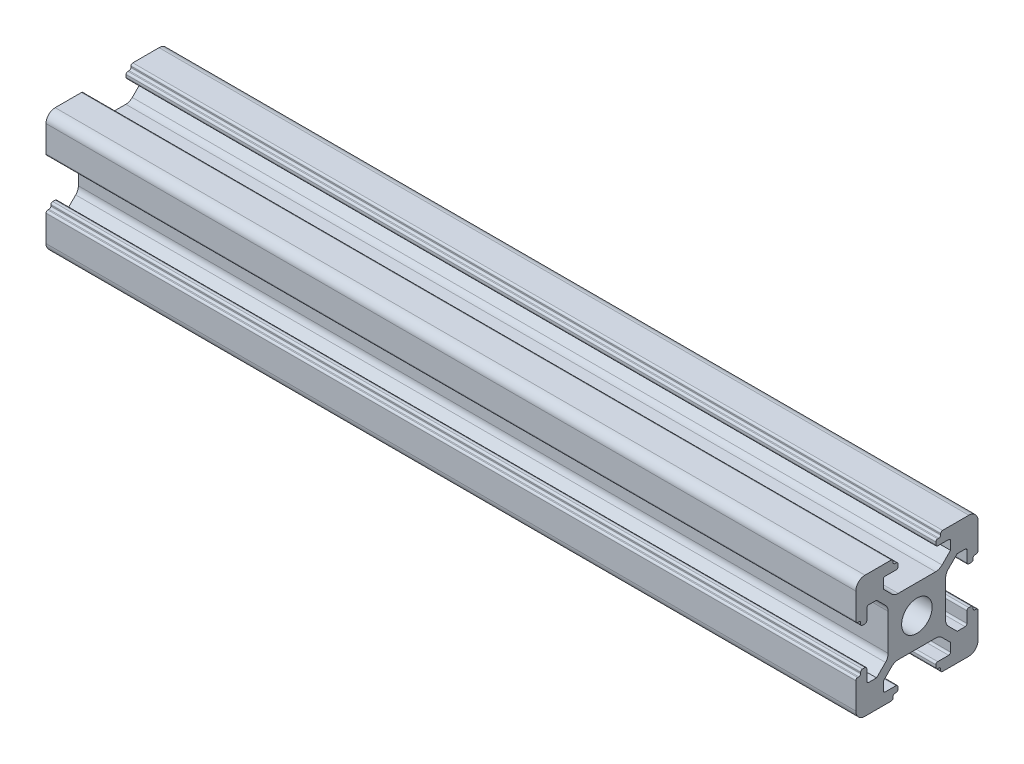
from build123d import *

# Parameters (mm, degrees)
SKETCH1_R           = 2.5
BOSS_EXTRUDE2_DEPTH = 66.25


with BuildPart() as part:
    # Sketch1 → Boss-Extrude2 (new, symmetric)
    with BuildSketch(Plane(origin=(0, 0, 0), x_dir=(0, 0, -1), z_dir=(1, 0, 0))):
        with BuildLine():
            Line((10, 4.2), (10, 8.5))
            ThreePointArc((10, 8.5), (9.560660172, 9.560660172), (8.5, 10))
            Line((8.5, 10), (4.2, 10))
            ThreePointArc((4.2, 10), (3.987867966, 9.912132034), (3.9, 9.7))
            Line((3.9, 9.7), (3.9, 9.5))
            ThreePointArc((3.9, 9.5), (3.812132034, 9.287867966), (3.6, 9.2))
            Line((3.6, 9.2), (3.4, 9.2))
            ThreePointArc((3.4, 9.2), (3.187867966, 9.112132034), (3.1, 8.9))
            Line((3.1, 8.9), (3.1, 8.5))
            ThreePointArc((3.1, 8.5), (3.187867966, 8.287867966), (3.4, 8.2))
            Line((3.4, 8.2), (5.2, 8.2))
            ThreePointArc((5.2, 8.2), (5.412132034, 8.112132034), (5.5, 7.9))
            Line((5.5, 7.9), (5.5, 6.521320344))
            Line((5.5, 6.521320344), (4.118019485, 5.139339828))
            ThreePointArc((4.118019485, 5.139339828), (3.631384461, 4.814180701), (3.057359313, 4.7))
            Line((3.057359313, 4.7), (-3.057359313, 4.7))
            ThreePointArc((-3.057359313, 4.7), (-3.631384461, 4.814180701), (-4.118019485, 5.139339828))
            Line((-4.118019485, 5.139339828), (-5.5, 6.521320344))
            Line((-5.5, 6.521320344), (-5.5, 7.9))
            ThreePointArc((-5.5, 7.9), (-5.412132034, 8.112132034), (-5.2, 8.2))
            Line((-5.2, 8.2), (-3.4, 8.2))
            ThreePointArc((-3.4, 8.2), (-3.187867966, 8.287867966), (-3.1, 8.5))
            Line((-3.1, 8.5), (-3.1, 8.9))
            ThreePointArc((-3.1, 8.9), (-3.187867966, 9.112132034), (-3.4, 9.2))
            Line((-3.4, 9.2), (-3.6, 9.2))
            ThreePointArc((-3.6, 9.2), (-3.812132034, 9.287867966), (-3.9, 9.5))
            Line((-3.9, 9.5), (-3.9, 9.7))
            ThreePointArc((-3.9, 9.7), (-3.987867966, 9.912132034), (-4.2, 10))
            Line((-4.2, 10), (-8.5, 10))
            ThreePointArc((-8.5, 10), (-9.560660172, 9.560660172), (-10, 8.5))
            Line((-10, 8.5), (-10, 4.2))
            ThreePointArc((-10, 4.2), (-9.912132034, 3.987867966), (-9.7, 3.9))
            Line((-9.7, 3.9), (-9.5, 3.9))
            ThreePointArc((-9.5, 3.9), (-9.287867966, 3.812132034), (-9.2, 3.6))
            Line((-9.2, 3.6), (-9.2, 3.4))
            ThreePointArc((-9.2, 3.4), (-9.112132034, 3.187867966), (-8.9, 3.1))
            Line((-8.9, 3.1), (-8.5, 3.1))
            ThreePointArc((-8.5, 3.1), (-8.287867966, 3.187867966), (-8.2, 3.4))
            Line((-8.2, 3.4), (-8.2, 5.2))
            ThreePointArc((-8.2, 5.2), (-8.112132034, 5.412132034), (-7.9, 5.5))
            Line((-7.9, 5.5), (-6.6, 5.5))
            Line((-6.6, 5.5), (-5.139339828, 4.039339828))
            ThreePointArc((-5.139339828, 4.039339828), (-4.814180701, 3.552704805), (-4.7, 2.978679656))
            Line((-4.7, 2.978679656), (-4.7, -2.978679656))
            ThreePointArc((-4.7, -2.978679656), (-4.814180701, -3.552704805), (-5.139339828, -4.039339828))
            Line((-5.139339828, -4.039339828), (-6.6, -5.5))
            Line((-6.6, -5.5), (-7.9, -5.5))
            ThreePointArc((-7.9, -5.5), (-8.112132034, -5.412132034), (-8.2, -5.2))
            Line((-8.2, -5.2), (-8.2, -3.4))
            ThreePointArc((-8.2, -3.4), (-8.287867966, -3.187867966), (-8.5, -3.1))
            Line((-8.5, -3.1), (-8.9, -3.1))
            ThreePointArc((-8.9, -3.1), (-9.112132034, -3.187867966), (-9.2, -3.4))
            Line((-9.2, -3.4), (-9.2, -3.6))
            ThreePointArc((-9.2, -3.6), (-9.287867966, -3.812132034), (-9.5, -3.9))
            Line((-9.5, -3.9), (-9.7, -3.9))
            ThreePointArc((-9.7, -3.9), (-9.912132034, -3.987867966), (-10, -4.2))
            Line((-10, -4.2), (-10, -8.5))
            ThreePointArc((-10, -8.5), (-9.560660172, -9.560660172), (-8.5, -10))
            Line((-8.5, -10), (-4.2, -10))
            ThreePointArc((-4.2, -10), (-3.987867966, -9.912132034), (-3.9, -9.7))
            Line((-3.9, -9.7), (-3.9, -9.5))
            ThreePointArc((-3.9, -9.5), (-3.812132034, -9.287867966), (-3.6, -9.2))
            Line((-3.6, -9.2), (-3.4, -9.2))
            ThreePointArc((-3.4, -9.2), (-3.187867966, -9.112132034), (-3.1, -8.9))
            Line((-3.1, -8.9), (-3.1, -8.5))
            ThreePointArc((-3.1, -8.5), (-3.187867966, -8.287867966), (-3.4, -8.2))
            Line((-3.4, -8.2), (-5.2, -8.2))
            ThreePointArc((-5.2, -8.2), (-5.412132034, -8.112132034), (-5.5, -7.9))
            Line((-5.5, -7.9), (-5.5, -6.521320344))
            Line((-5.5, -6.521320344), (-4.118019485, -5.139339828))
            ThreePointArc((-4.118019485, -5.139339828), (-3.631384461, -4.814180701), (-3.057359313, -4.7))
            Line((-3.057359313, -4.7), (3.057359313, -4.7))
            ThreePointArc((3.057359313, -4.7), (3.631384461, -4.814180701), (4.118019485, -5.139339828))
            Line((4.118019485, -5.139339828), (5.5, -6.521320344))
            Line((5.5, -6.521320344), (5.5, -7.9))
            ThreePointArc((5.5, -7.9), (5.412132034, -8.112132034), (5.2, -8.2))
            Line((5.2, -8.2), (3.4, -8.2))
            ThreePointArc((3.4, -8.2), (3.187867966, -8.287867966), (3.1, -8.5))
            Line((3.1, -8.5), (3.1, -8.9))
            ThreePointArc((3.1, -8.9), (3.187867966, -9.112132034), (3.4, -9.2))
            Line((3.4, -9.2), (3.6, -9.2))
            ThreePointArc((3.6, -9.2), (3.812132034, -9.287867966), (3.9, -9.5))
            Line((3.9, -9.5), (3.9, -9.7))
            ThreePointArc((3.9, -9.7), (3.987867966, -9.912132034), (4.2, -10))
            Line((4.2, -10), (8.5, -10))
            ThreePointArc((8.5, -10), (9.560660172, -9.560660172), (10, -8.5))
            Line((10, -8.5), (10, -4.2))
            ThreePointArc((10, -4.2), (9.912132034, -3.987867966), (9.7, -3.9))
            Line((9.7, -3.9), (9.5, -3.9))
            ThreePointArc((9.5, -3.9), (9.287867966, -3.812132034), (9.2, -3.6))
            Line((9.2, -3.6), (9.2, -3.4))
            ThreePointArc((9.2, -3.4), (9.112132034, -3.187867966), (8.9, -3.1))
            Line((8.9, -3.1), (8.5, -3.1))
            ThreePointArc((8.5, -3.1), (8.287867966, -3.187867966), (8.2, -3.4))
            Line((8.2, -3.4), (8.2, -5.2))
            ThreePointArc((8.2, -5.2), (8.112132034, -5.412132034), (7.9, -5.5))
            Line((7.9, -5.5), (6.6, -5.5))
            Line((6.6, -5.5), (5.139339828, -4.039339828))
            ThreePointArc((5.139339828, -4.039339828), (4.814180701, -3.552704805), (4.7, -2.978679656))
            Line((4.7, -2.978679656), (4.7, 2.978679656))
            ThreePointArc((4.7, 2.978679656), (4.814180701, 3.552704805), (5.139339828, 4.039339828))
            Line((5.139339828, 4.039339828), (6.6, 5.5))
            Line((6.6, 5.5), (7.9, 5.5))
            ThreePointArc((7.9, 5.5), (8.112132034, 5.412132034), (8.2, 5.2))
            Line((8.2, 5.2), (8.2, 3.4))
            ThreePointArc((8.2, 3.4), (8.287867966, 3.187867966), (8.5, 3.1))
            Line((8.5, 3.1), (8.9, 3.1))
            ThreePointArc((8.9, 3.1), (9.112132034, 3.187867966), (9.2, 3.4))
            Line((9.2, 3.4), (9.2, 3.6))
            ThreePointArc((9.2, 3.6), (9.287867966, 3.812132034), (9.5, 3.9))
            Line((9.5, 3.9), (9.7, 3.9))
            ThreePointArc((9.7, 3.9), (9.912132034, 3.987867966), (10, 4.2))
        make_face()
        Circle(SKETCH1_R, mode=Mode.SUBTRACT)
    extrude(amount=BOSS_EXTRUDE2_DEPTH, both=True)


solid = part.part
